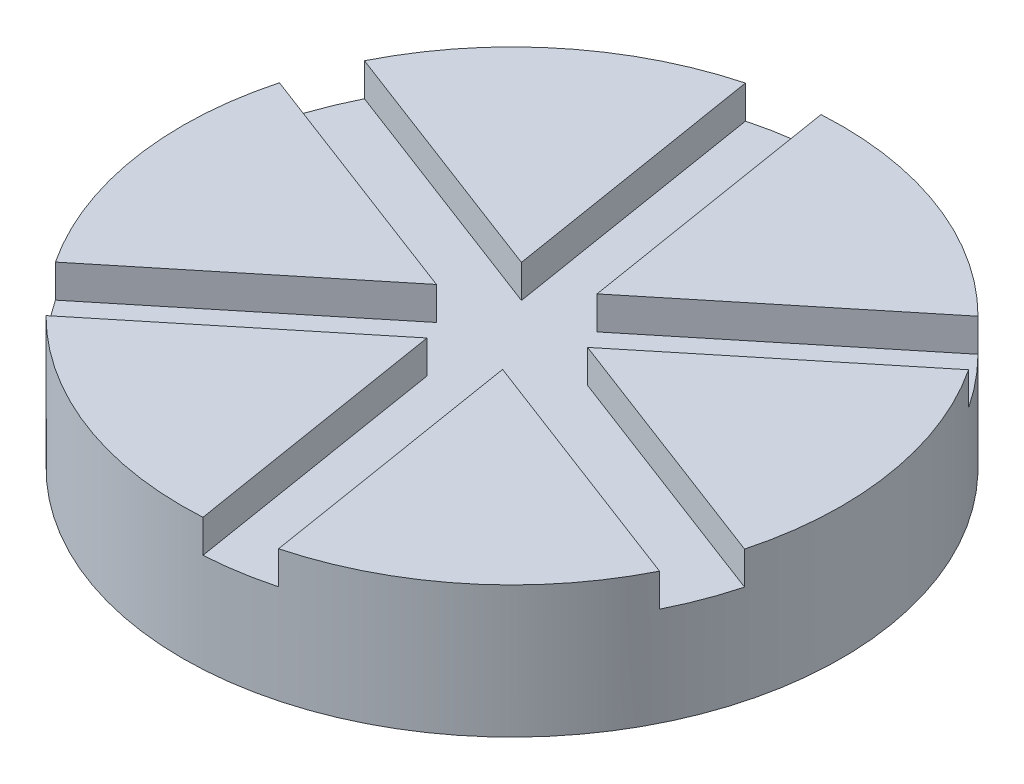
from build123d import *

# Parameters (mm, degrees)
SKETCH1_R           = 127
BOSS_EXTRUDE1_DEPTH = 50.8
CUT_EXTRUDE1_DEPTH  = 12.7


with BuildPart() as part:
    # Sketch1 → Boss-Extrude1 (new body)
    with BuildSketch(Plane(origin=(0, 0, 0), x_dir=(1, 0, 0), z_dir=(0, 1, 0))):
        with Locations(Location((0, 0, 0), (0, 0, 270))):
            Circle(SKETCH1_R)
    extrude(amount=BOSS_EXTRUDE1_DEPTH)

    # Sketch2 → Cut-Extrude1 (cut)
    with BuildSketch(Plane(origin=(0, 50.8, 0), x_dir=(1, 0, 0), z_dir=(0, 1, 0))):
        Polygon((-90.39681042, -90.103865988), (-106.44912427, -70.419272519), (-25.073514933, -4.05941485), (-123.230642135, 33.23400125), (-114.209441053, 56.978009569), (-16.052313851, 19.684593469), (-32.833831715, 123.337867238), (-7.760316782, 127.397282088), (9.021201082, 23.744008319), (90.39681042, 90.103865988), (106.44912427, 70.419272519), (25.073514933, 4.05941485), (123.230642135, -33.23400125), (114.209441053, -56.978009569), (16.052313851, -19.684593469), (32.833831715, -123.337867238), (7.760316782, -127.397282088), (-9.021201082, -23.744008319), align=None)
    extrude(amount=-CUT_EXTRUDE1_DEPTH, mode=Mode.SUBTRACT)


solid = part.part
